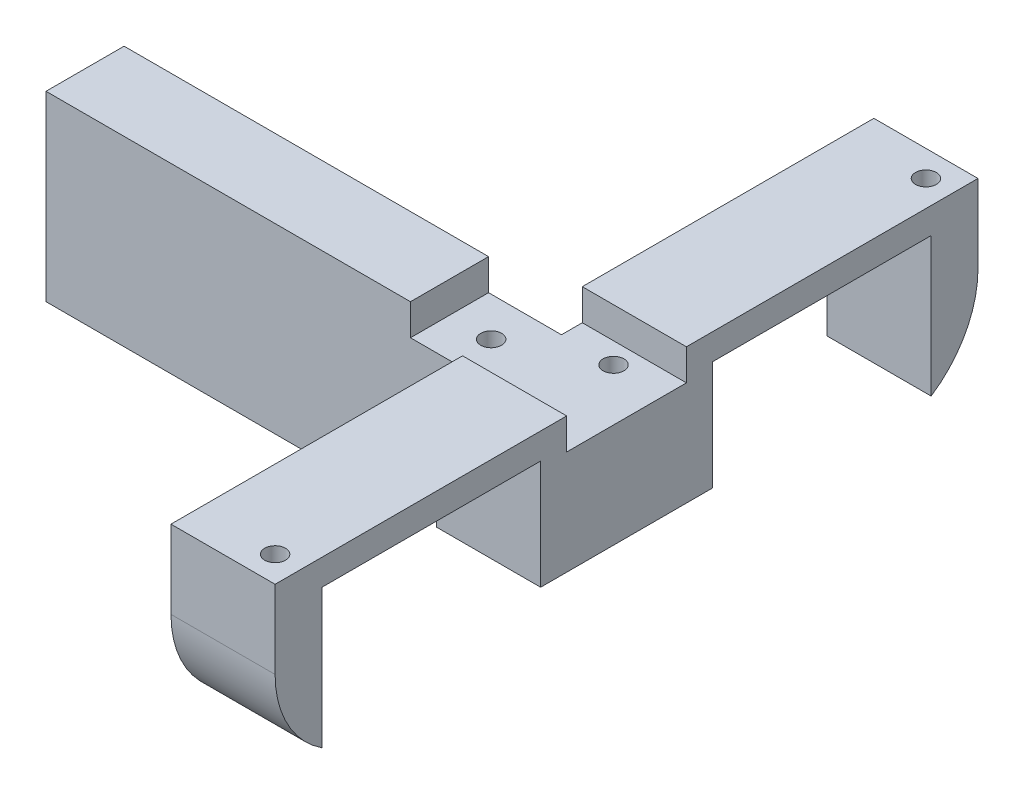
from build123d import *

# Parameters (mm, degrees)
BOSS_EXTRUDE1_DEPTH = 35
CUT_EXTRUDE1_REACH  = 163.307
SKETCH2_W           = 42
SKETCH2_H           = 21
SKETCH3_R           = 2
CUT_EXTRUDE2_DEPTH  = 10
FILLET1_R           = 20
CUT_EXTRUDE5_REACH  = 163.307
SKETCH6_W           = 42
SKETCH6_H           = 9
SKETCH7_R           = 2
CUT_EXTRUDE6_DEPTH  = 10
CUT_EXTRUDE7_DEPTH  = 9
SKETCH9_R           = 2
CUT_EXTRUDE8_DEPTH  = 10
CUT_EXTRUDE9_DEPTH  = 6
SKETCH11_R          = 2
CUT_EXTRUDE10_DEPTH = 9
SKETCH12_R          = 2
CUT_EXTRUDE11_DEPTH = 10


with BuildPart() as part:
    # Sketch1 → Boss-Extrude1 (new body)
    with BuildSketch(Plane(origin=(0, 0, 0), x_dir=(1, 0, 0), z_dir=(0, 1, 0))):
        Polygon((-38.317617866, 43.23325062), (45.682382134, 43.23325062), (45.682382134, -16.76674938), (65.682382134, -16.76674938), (65.682382134, 118.23325062), (45.682382134, 118.23325062), (45.682382134, 58.23325062), (-38.317617866, 58.23325062), align=None)
    extrude(amount=BOSS_EXTRUDE1_DEPTH)

    # Sketch2 → Cut-Extrude1 (cut, up to next)
    with BuildSketch(Plane(origin=(65.682382134, 0, 0), x_dir=(0, 0, -1), z_dir=(1, 0, 0)), mode=Mode.PRIVATE) as cut_extrude1_sk1:
        with Locations((13.23325062, 19.5)):
            Rectangle(SKETCH2_W, SKETCH2_H)
    cut_extrude1_tool1 = extrude(cut_extrude1_sk1.sketch, amount=-CUT_EXTRUDE1_REACH, mode=Mode.PRIVATE) & part.part
    # Sketch2 → Cut-Extrude1 (cut, up to next)
    with BuildSketch(Plane(origin=(65.682382134, 0, 0), x_dir=(0, 0, -1), z_dir=(1, 0, 0)), mode=Mode.PRIVATE) as cut_extrude1_sk2:
        with Locations((88.23325062, 19.5)):
            Rectangle(SKETCH2_W, SKETCH2_H)
    cut_extrude1_tool2 = extrude(cut_extrude1_sk2.sketch, amount=-CUT_EXTRUDE1_REACH, mode=Mode.PRIVATE) & part.part
    add(cut_extrude1_tool1.solids().sort_by_distance((65.682382, 19.5, -13.233251))[0], mode=Mode.SUBTRACT)
    add(cut_extrude1_tool2.solids().sort_by_distance((65.682382, 19.5, -88.233251))[0], mode=Mode.SUBTRACT)

    # Sketch3 → Cut-Extrude2 (cut)
    with BuildSketch(Plane.ZY.offset(-45.682382134)):
        with Locations((11.26674938, 24.75)):
            Circle(SKETCH3_R)
        with Locations((11.26674938, 15.25)):
            Circle(SKETCH3_R)
        with Locations((-37.73325062, 24.75)):
            Circle(SKETCH3_R)
        with Locations((-37.73325062, 15.25)):
            Circle(SKETCH3_R)
        with Locations(Location((-112.73325062, 24.75, 0), (0, 0, 180))):
            Circle(SKETCH3_R)
        with Locations(Location((-112.73325062, 15.25, 0), (0, 0, 180))):
            Circle(SKETCH3_R)
        with Locations(Location((-63.73325062, 15.25, 0), (0, 0, 180))):
            Circle(SKETCH3_R)
        with Locations(Location((-63.73325062, 24.75, 0), (0, 0, 180))):
            Circle(SKETCH3_R)
    extrude(amount=-CUT_EXTRUDE2_DEPTH, mode=Mode.SUBTRACT)

    # Fillet1
    fillet1_edges = [part.edges().sort_by_distance(p)[0] for p in [
        (55.682382134, 0, -118.23325062),
        (55.682382134, 0, 16.76674938),
    ]]
    fillet(fillet1_edges, radius=FILLET1_R)

    # Sketch6 → Cut-Extrude5 (cut, up to next)
    with BuildSketch(Plane(origin=(65.682382134, 0, 0), x_dir=(0, 0, -1), z_dir=(1, 0, 0)), mode=Mode.PRIVATE) as cut_extrude5_sk1:
        with Locations((13.23325062, 4.5)):
            Rectangle(SKETCH6_W, SKETCH6_H)
    cut_extrude5_tool1 = extrude(cut_extrude5_sk1.sketch, amount=-CUT_EXTRUDE5_REACH, mode=Mode.PRIVATE) & part.part
    # Sketch6 → Cut-Extrude5 (cut, up to next)
    with BuildSketch(Plane(origin=(65.682382134, 0, 0), x_dir=(0, 0, -1), z_dir=(1, 0, 0)), mode=Mode.PRIVATE) as cut_extrude5_sk2:
        with Locations((88.23325062, 4.5)):
            Rectangle(SKETCH6_W, SKETCH6_H)
    cut_extrude5_tool2 = extrude(cut_extrude5_sk2.sketch, amount=-CUT_EXTRUDE5_REACH, mode=Mode.PRIVATE) & part.part
    add(cut_extrude5_tool1.solids().sort_by_distance((65.682382, 4.5, -13.233251))[0], mode=Mode.SUBTRACT)
    add(cut_extrude5_tool2.solids().sort_by_distance((65.682382, 4.5, -88.233251))[0], mode=Mode.SUBTRACT)

    # Sketch7 → Cut-Extrude6 (cut)
    with BuildSketch(Plane.ZY.offset(38.317617866)):
        with Locations((-50.73325062, 25)):
            Circle(SKETCH7_R)
        with Locations((-50.73325062, 10)):
            Circle(SKETCH7_R)
    extrude(amount=-CUT_EXTRUDE6_DEPTH, mode=Mode.SUBTRACT)

    # Sketch8 → Cut-Extrude7 (cut)
    with BuildSketch(Plane.XZ):
        Polygon((45.682382134, -67.23325062), (45.682382134, -58.23325062), (25.682382134, -58.23325062), (25.682382134, -43.23325062), (45.682382134, -43.23325062), (45.682382134, -34.23325062), (65.682382134, -34.23325062), (65.682382134, -67.23325062), align=None)
    extrude(amount=-CUT_EXTRUDE7_DEPTH, mode=Mode.SUBTRACT)

    # Sketch9 → Cut-Extrude8 (cut)
    with BuildSketch(Plane.XZ.offset(-9)):
        with Locations(Location((55.682382134, -42.23325062, 0), (0, 0, 270))):
            Circle(SKETCH9_R)
        with Locations(Location((55.682382134, -59.23325062, 0), (0, 0, 270))):
            Circle(SKETCH9_R)
        with Locations(Location((35.682382134, -50.73325062, 0), (0, 0, 270))):
            Circle(SKETCH9_R)
    extrude(amount=-CUT_EXTRUDE8_DEPTH, mode=Mode.SUBTRACT)

    # Sketch10 → Cut-Extrude9 (cut)
    with BuildSketch(Plane(origin=(0, 35, 0), x_dir=(1, 0, 0), z_dir=(0, 1, 0))):
        Polygon((45.682382134, 62.23325062), (65.682382134, 62.23325062), (65.682382134, 39.23325062), (45.682382134, 39.23325062), (45.682382134, 43.23325062), (31.682382134, 43.23325062), (31.682382134, 58.23325062), (45.682382134, 58.23325062), align=None)
    extrude(amount=-CUT_EXTRUDE9_DEPTH, mode=Mode.SUBTRACT)

    # Sketch11 → Cut-Extrude10 (cut)
    with BuildSketch(Plane(origin=(0, 29, 0), x_dir=(1, 0, 0), z_dir=(0, 1, 0))):
        with Locations(Location((55.682382134, 58.23325062, 0), (0, 0, 270))):
            Circle(SKETCH11_R)
        with Locations(Location((55.682382134, 43.23325062, 0), (0, 0, 270))):
            Circle(SKETCH11_R)
        with Locations(Location((39.682382134, 50.73325062, 0), (0, 0, 270))):
            Circle(SKETCH11_R)
    extrude(amount=-CUT_EXTRUDE10_DEPTH, mode=Mode.SUBTRACT)

    # Sketch12 → Cut-Extrude11 (cut)
    with BuildSketch(Plane(origin=(0, 35, 0), x_dir=(1, 0, 0), z_dir=(0, 1, 0))):
        with Locations(Location((60.682382134, -11.76674938, 0), (0, 0, 270))):
            Circle(SKETCH12_R)
        with Locations(Location((60.682382134, 113.23325062, 0), (0, 0, 270))):
            Circle(SKETCH12_R)
    extrude(amount=-CUT_EXTRUDE11_DEPTH, mode=Mode.SUBTRACT)


solid = part.part
